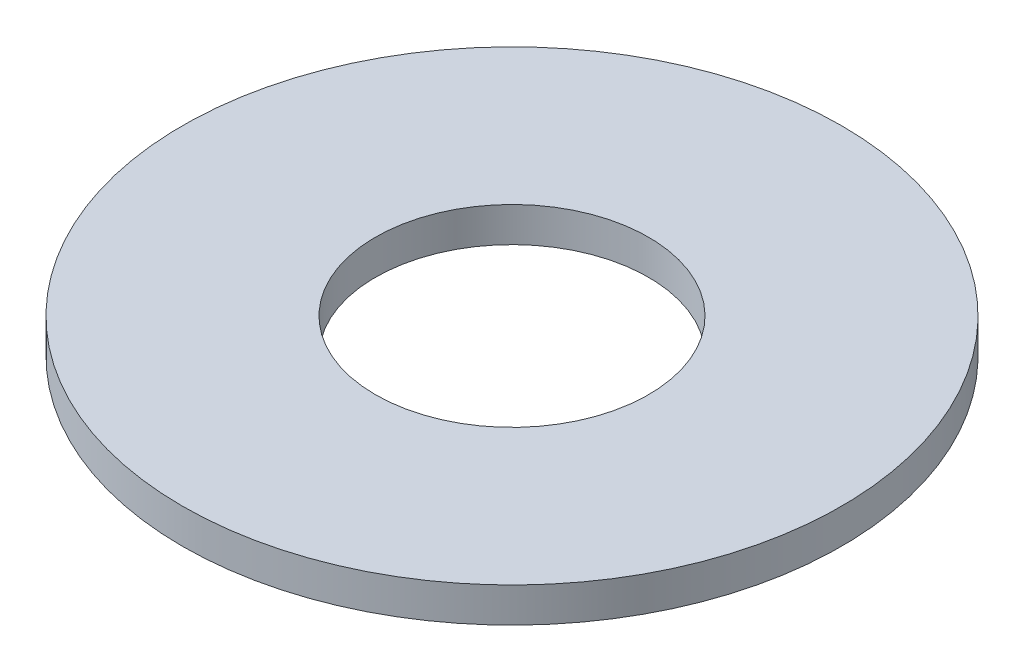
from build123d import *

# Parameters (mm, degrees)
SKETCH1_R           = 37.9
SKETCH1_R_2         = 15.7
BOSS_EXTRUDE1_DEPTH = 4


with BuildPart() as part:
    # Sketch1 → Boss-Extrude1 (new body)
    with BuildSketch(Plane(origin=(0, 0, 0), x_dir=(1, 0, 0), z_dir=(0, 1, 0))):
        with Locations(Location((0, 0, 0), (0, 0, 270))):
            Circle(SKETCH1_R)
        with Locations(Location((0, 0, 0), (0, 0, 270))):
            Circle(SKETCH1_R_2, mode=Mode.SUBTRACT)
    extrude(amount=BOSS_EXTRUDE1_DEPTH)


solid = part.part
